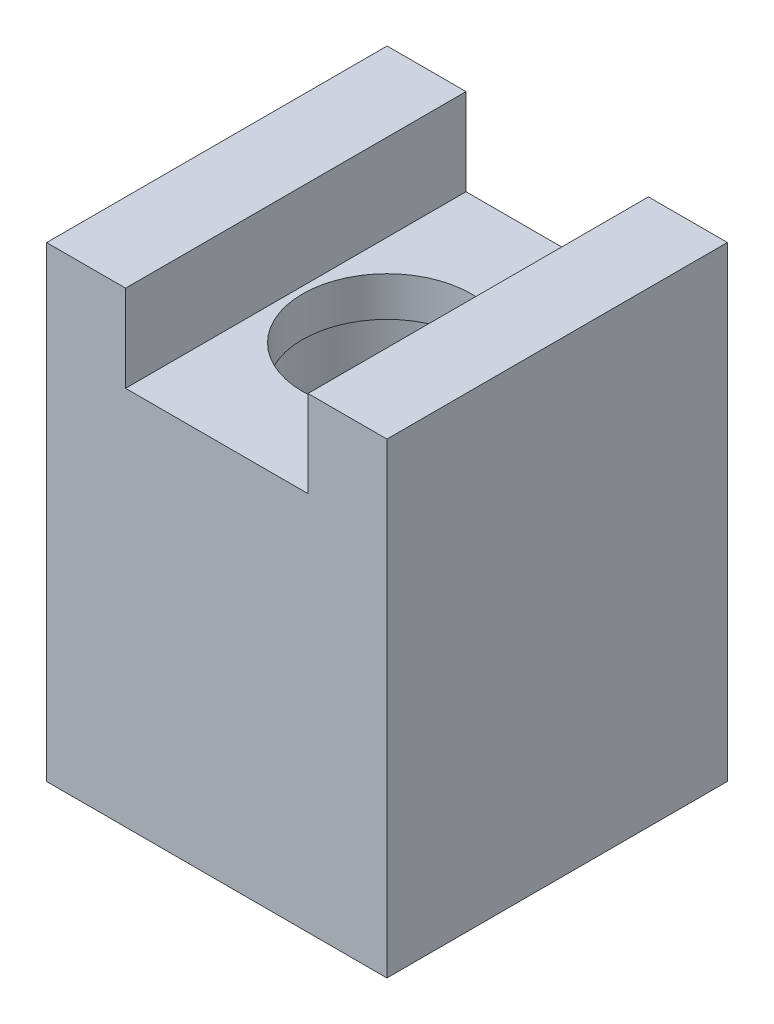
from build123d import *

# Parameters (mm, degrees)
SKETCH1_W                                = 30.43428
SKETCH1_H                                = 30.44952
BOSS_EXTRUDE1_DEPTH                      = 41.74236
SKETCH4_R                                = 7.5565
CUT_EXTRUDE3_DEPTH                       = 36.539424
SKETCH6_W                                = 16.31188
SKETCH6_H                                = 30.44952
CUT_EXTRUDE5_DEPTH                       = 7.75716
SKETCH8_R                                = 11.2776
CUT_EXTRUDE6_DEPTH                       = 30.44952
F_1_16_0_0625_DIAMETER_HOLE1_D           = 1.5875
F_1_16_0_0625_DIAMETER_HOLE1_DEPTH       = 12.7
F_1_16_0_0625_DIAMETER_HOLE1_CSINK_D     = 2.8575
F_1_16_0_0625_DIAMETER_HOLE1_CSINK_ANGLE = 90
F_1_16_0_0625_DIAMETER_HOLE1_TIP         = 0.476933116


with BuildPart() as part:
    # Sketch1 → Boss-Extrude1 (new body)
    with BuildSketch(Plane(origin=(0, 0, 0), x_dir=(1, 0, 0), z_dir=(0, 1, 0))):
        Rectangle(SKETCH1_W, SKETCH1_H)
    extrude(amount=BOSS_EXTRUDE1_DEPTH)

    # Sketch4 → Cut-Extrude3 (cut)
    with BuildSketch(Plane.XZ):
        with Locations(Location((0, 0, 0), (0, 0, 270))):
            Circle(SKETCH4_R)
    extrude(amount=-CUT_EXTRUDE3_DEPTH, mode=Mode.SUBTRACT)

    # Sketch6 → Cut-Extrude5 (cut)
    with BuildSketch(Plane(origin=(0, 41.74236, 0), x_dir=(1, 0, 0), z_dir=(0, 1, 0))):
        Rectangle(SKETCH6_W, SKETCH6_H)
    extrude(amount=-CUT_EXTRUDE5_DEPTH, mode=Mode.SUBTRACT)

    # Sketch8 → Cut-Extrude6 (cut)
    with BuildSketch(Plane.XZ):
        with Locations(Location((0, 0, 0), (0, 0, 270))):
            Circle(SKETCH8_R)
    extrude(amount=-CUT_EXTRUDE6_DEPTH, mode=Mode.SUBTRACT)

    # 1/16 (0.0625) Diameter Hole1
    with Locations(Plane(origin=(0, 0, 0), x_dir=(-1, 0, 0), z_dir=(0, -1, 0))):
        with Locations((-11.6205, 11.62812), (11.6205, 11.62812), (11.6205, -11.62812), (-11.6205, -11.62812)):
            CounterSinkHole(F_1_16_0_0625_DIAMETER_HOLE1_D / 2, F_1_16_0_0625_DIAMETER_HOLE1_CSINK_D / 2, depth=F_1_16_0_0625_DIAMETER_HOLE1_DEPTH, counter_sink_angle=F_1_16_0_0625_DIAMETER_HOLE1_CSINK_ANGLE)
            with Locations((0, 0, -(F_1_16_0_0625_DIAMETER_HOLE1_DEPTH + F_1_16_0_0625_DIAMETER_HOLE1_TIP / 2))):  # 118° drill point
                Cone(0, F_1_16_0_0625_DIAMETER_HOLE1_D / 2, F_1_16_0_0625_DIAMETER_HOLE1_TIP, mode=Mode.SUBTRACT)


solid = part.part
